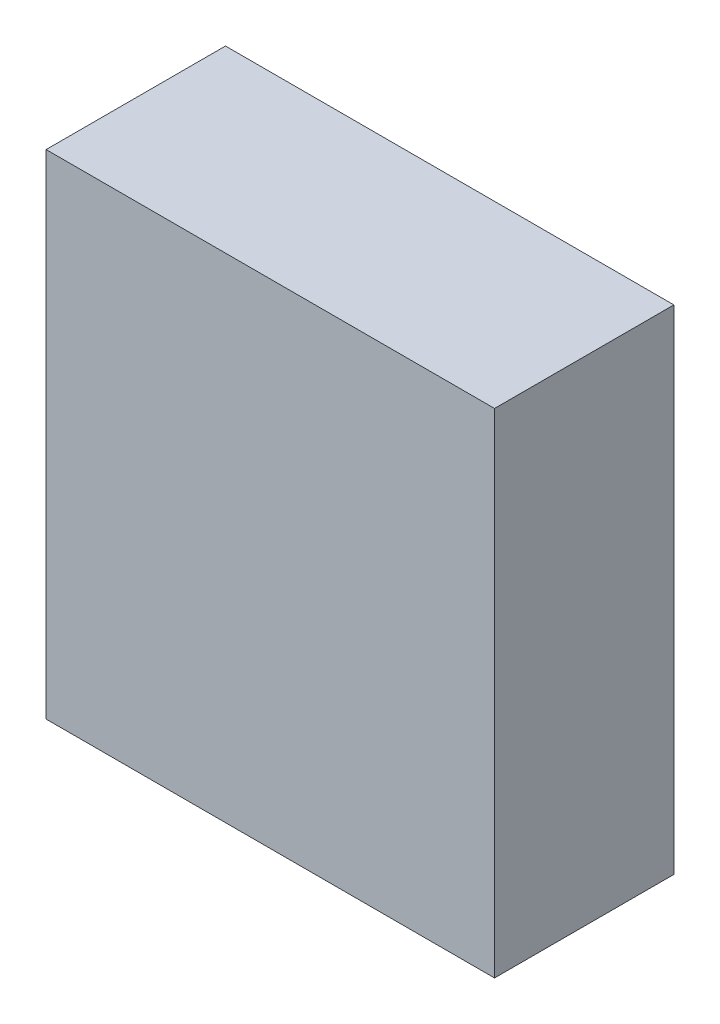
from build123d import *

# Parameters (mm, degrees)
SKETCH1_W           = 250
SKETCH1_H           = 100
BOSS_EXTRUDE1_DEPTH = 275


with BuildPart() as part:
    # Sketch1 → Boss-Extrude1 (new body)
    with BuildSketch(Plane(origin=(0, 0, 0), x_dir=(1, 0, 0), z_dir=(0, 1, 0))):
        with Locations((125, 50)):
            Rectangle(SKETCH1_W, SKETCH1_H)
    extrude(amount=BOSS_EXTRUDE1_DEPTH)


solid = part.part
